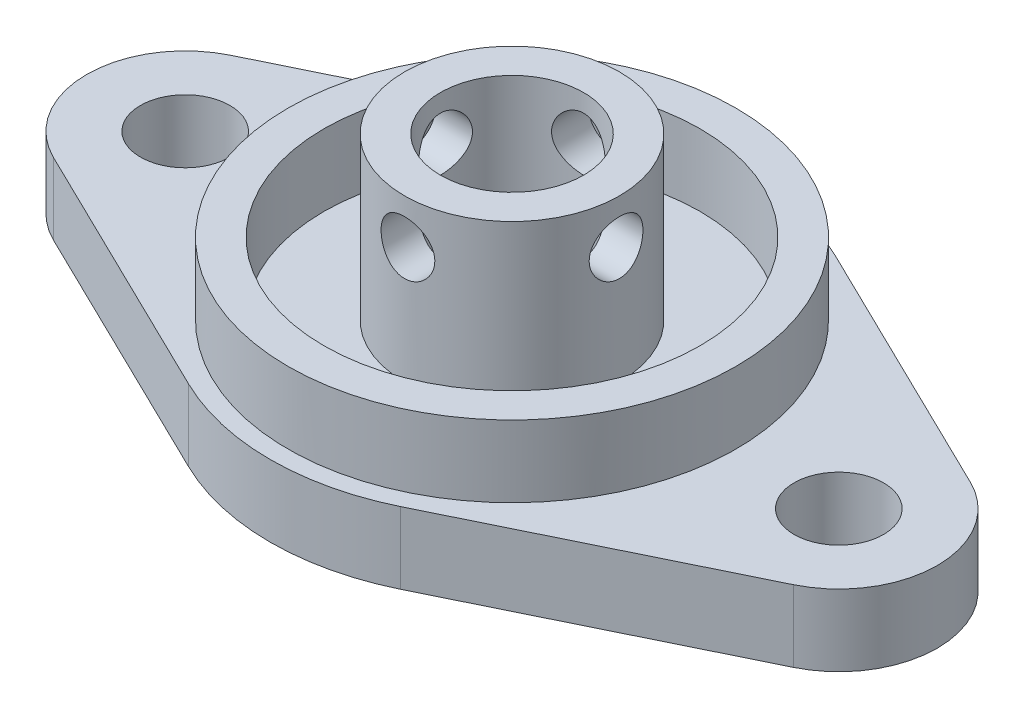
from build123d import *

# Parameters (mm, degrees)
SKETCH1_R           = 2.5
BOSS_EXTRUDE1_DEPTH = 4
SKETCH2_R           = 12.5
SKETCH2_R_2         = 10.5
EXTRUDE_THIN1_DEPTH = 4
SKETCH3_R           = 6
SKETCH3_R_2         = 4
EXTRUDE_THIN2_DEPTH = 9
SKETCH4_R           = 1.5
CUT_EXTRUDE1_DEPTH  = 31.254131949
CIRPATTERN1_COUNT   = 2
CIRPATTERN1_ANGLE   = 90


with BuildPart() as part:
    # Sketch1 → Boss-Extrude1 (new body)
    with BuildSketch(Plane(origin=(0, 0, 0), x_dir=(1, 0, 0), z_dir=(0, 1, 0))):
        with BuildLine():
            Line((20.660958904, 4.943407445), (5.917808219, 12.133818273))
            ThreePointArc((5.917808219, 12.133818273), (0, 13.5), (-5.917808219, 12.133818273))
            Line((-5.917808219, 12.133818273), (-20.660958904, 4.943407445))
            ThreePointArc((-20.660958904, 4.943407445), (-23.75, 0), (-20.660958904, -4.943407445))
            Line((-20.660958904, -4.943407445), (-5.917808219, -12.133818273))
            ThreePointArc((-5.917808219, -12.133818273), (0, -13.5), (5.917808219, -12.133818273))
            Line((5.917808219, -12.133818273), (20.660958904, -4.943407445))
            ThreePointArc((20.660958904, -4.943407445), (23.75, 0), (20.660958904, 4.943407445))
        make_face()
        with Locations(Location((18.25, 0, 0), (0, 0, 270))):
            Circle(SKETCH1_R, mode=Mode.SUBTRACT)
        with Locations(Location((-18.25, 0, 0), (0, 0, 90))):
            Circle(SKETCH1_R, mode=Mode.SUBTRACT)
    extrude(amount=BOSS_EXTRUDE1_DEPTH)

    # Sketch2 → Extrude-Thin1 (add)
    with BuildSketch(Plane(origin=(0, 4, 0), x_dir=(1, 0, 0), z_dir=(0, 1, 0))):
        Circle(SKETCH2_R)
        Circle(SKETCH2_R_2, mode=Mode.SUBTRACT)
    extrude(amount=EXTRUDE_THIN1_DEPTH)

    # Sketch3 → Extrude-Thin2 (add)
    with BuildSketch(Plane(origin=(0, 4, 0), x_dir=(1, 0, 0), z_dir=(0, 1, 0))):
        Circle(SKETCH3_R)
        Circle(SKETCH3_R_2, mode=Mode.SUBTRACT)
    extrude(amount=EXTRUDE_THIN2_DEPTH)

    # Sketch4 → Cut-Extrude1 (cut, symmetric)
    with BuildSketch(Plane.XY):
        with Locations((0, 10.5)):
            Circle(SKETCH4_R)
    cut_extrude1 = extrude(amount=CUT_EXTRUDE1_DEPTH, both=True, mode=Mode.SUBTRACT)

    # CirPattern1: Cut-Extrude1 ×2 about axis
    cirpattern1_axis = Axis((0, 13, 0), (0, 1, 0))
    for i in range(1, CIRPATTERN1_COUNT):
        add(cut_extrude1.rotate(cirpattern1_axis, i * CIRPATTERN1_ANGLE / (CIRPATTERN1_COUNT - 1)), mode=Mode.SUBTRACT)


solid = part.part
